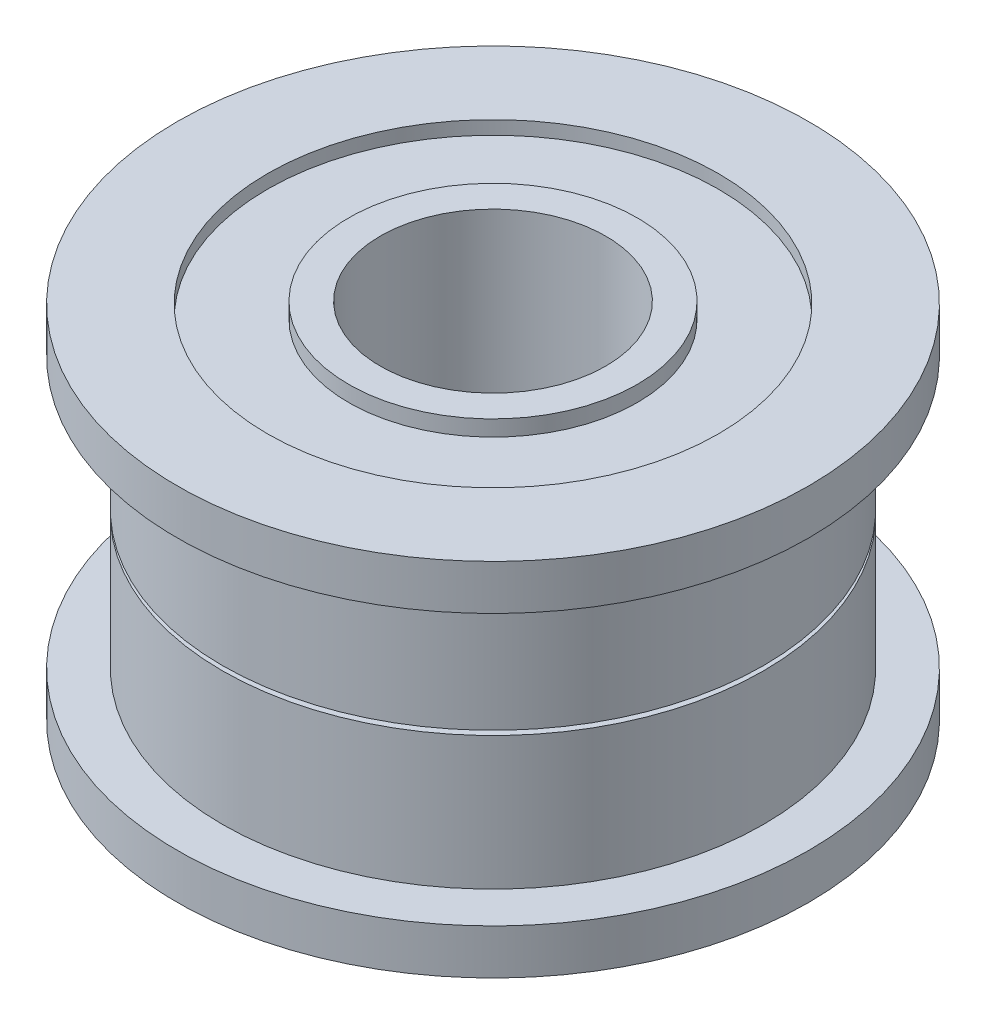
from build123d import *

# Parameters (mm, degrees)
SKETCH_1_W = 0.7
SKETCH_1_H = 0.05


with BuildPart() as part:
    # 草图1 → 旋转1 (revolve)
    with BuildSketch(Plane.XY):
        Polygon((2.5, 4), (2.5, 0), (3.2, 0), (3.2, 0.3), (5, 0.3), (5, 0), (7, 0), (7, 1), (6, 1), (6, 3.95), (5, 3.95), (5, 3.7), (3.2, 3.7), (3.2, 4), align=None)
        with Locations((2.85, -0.025)):
            Rectangle(SKETCH_1_W, SKETCH_1_H)
        with Locations((2.85, 4.025)):
            Rectangle(SKETCH_1_W, SKETCH_1_H)
    revolve_1 = revolve(axis=Axis((0, -1000, 0), (0, 1, 0)))

    # 镜向1: 旋转1 across plane
    add(revolve_1.mirror(Plane.ZX.offset(4)))


solid = part.part
